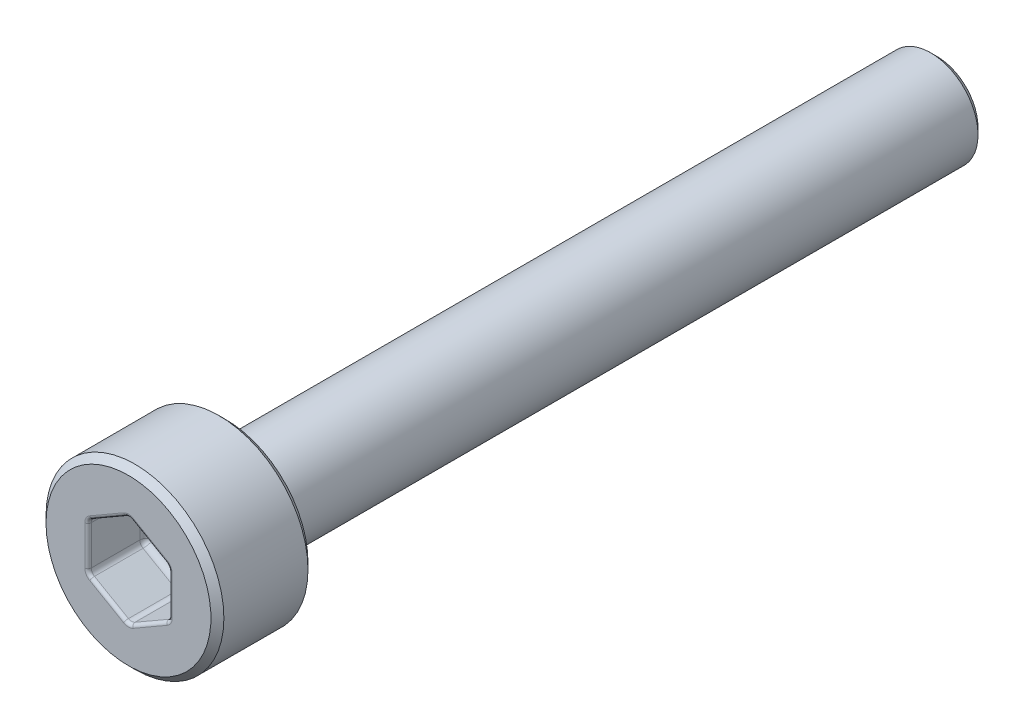
from build123d import *

# Parameters (mm, degrees)
SCHNITT_LINEAR_AUSTRAGEN1_DEPTH = 1.8
FASE1_SIZE                      = 0.2
VERRUNDUNG1_R                   = 0.2
VERRUNDUNG2_R                   = 0.1


with BuildPart() as part:
    # Skizze1 → Rotation1 (revolve)
    with BuildSketch(Plane(origin=(0, 0, 0), x_dir=(0, 0, -1), z_dir=(1, 0, 0))):
        Polygon((-3, 0), (-3, 2.75), (0, 2.75), (0, 1.465), (22, 1.465), (22, 0), align=None)
    revolve(axis=Axis((0, 0, 21.919879518), (0, 0, -1)))

    # Skizze2 → Schnitt-Linear austragen1 (cut)
    with BuildSketch(Plane.XY.offset(3)):
        Polygon((1.25, -0.721687836), (1.25, 0.721687836), (0, 1.443375673), (-1.25, 0.721687836), (-1.25, -0.721687836), (0, -1.443375673), align=None)
    extrude(amount=-SCHNITT_LINEAR_AUSTRAGEN1_DEPTH, mode=Mode.SUBTRACT)

    # Fase1
    fase1_edges = [part.edges().sort_by_distance(p)[0] for p in [
        (0, -2.75, 3),
        (0, -2.75, 0),
        (0, -1.465, -22),
    ]]
    chamfer(fase1_edges, length=FASE1_SIZE)

    # Verrundung1
    verrundung1_edges = [part.edges().sort_by_distance(p)[0] for p in [
        (-0.625, -1.082531755, 1.2),
        (-1.25, 0, 1.2),
        (-0.625, 1.082531755, 1.2),
        (0.625, 1.082531755, 1.2),
        (1.25, 0, 1.2),
        (0.625, -1.082531755, 1.2),
        (-1.25, -0.721687836, 2.1),
        (0, -1.443375673, 2.1),
        (1.25, -0.721687836, 2.1),
        (1.25, 0.721687836, 2.1),
        (0, 1.443375673, 2.1),
        (-1.25, 0.721687836, 2.1),
        (0, -1.465, 0),
    ]]
    fillet(verrundung1_edges, radius=VERRUNDUNG1_R)

    # Verrundung2
    verrundung2_edges = [part.edges().sort_by_distance(p)[0] for p in [
        (1.223205081, -0.706217783, 3),
        (0.625, -1.082531755, 3),
        (0, -1.412435565, 3),
        (-0.625, -1.082531755, 3),
        (-1.223205081, -0.706217783, 3),
        (-1.25, 0, 3),
        (-1.223205081, 0.706217783, 3),
        (-0.625, 1.082531755, 3),
        (0, 1.412435565, 3),
        (0.625, 1.082531755, 3),
        (1.223205081, 0.706217783, 3),
        (1.25, 0, 3),
    ]]
    fillet(verrundung2_edges, radius=VERRUNDUNG2_R)


solid = part.part
